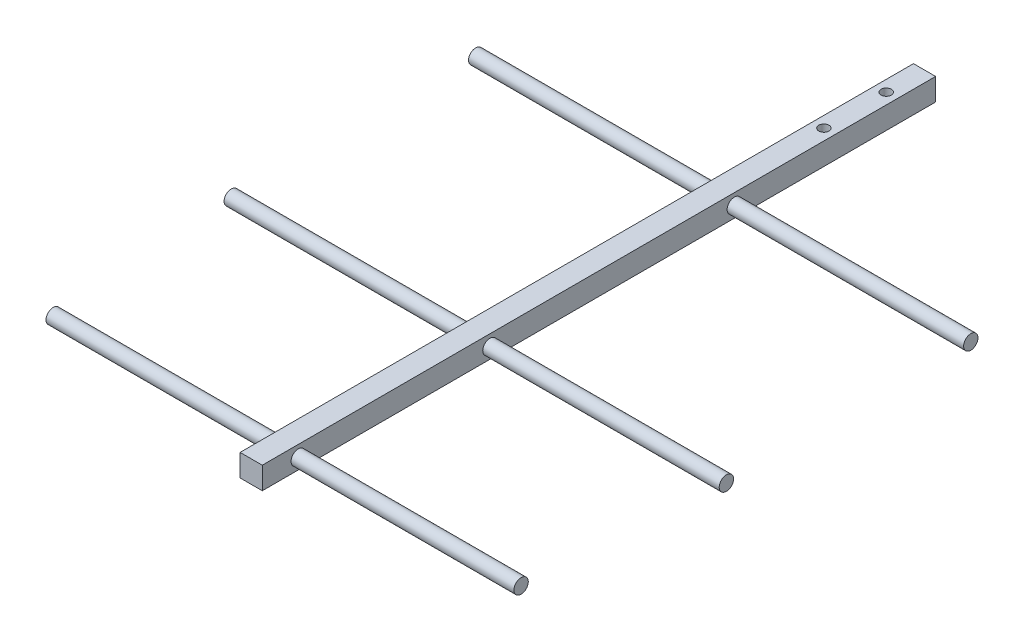
from build123d import *

# Parameters (mm, degrees)
SKETCH1_W                = 14.684375
SKETCH1_H                = 14.684375
BOSS_EXTRUDE1_DEPTH      = 446.0875
SKETCH9_R                = 3.384543224
CUT_EXTRUDE1_DEPTH       = 447.389511797
BOSS_EXTRUDE7_DEPTH      = 155
BOSS_EXTRUDE7_DEPTH_BACK = 155
SKETCH3_R                = 4.7625
BOSS_EXTRUDE8_DEPTH      = 164
BOSS_EXTRUDE8_DEPTH_BACK = 164
SKETCH3_3_R              = 4.7625
BOSS_EXTRUDE9_DEPTH      = 164
BOSS_EXTRUDE9_DEPTH_BACK = 164
SKETCH3_4_R              = 4.7625


with BuildPart() as part:
    # Sketch1 → Boss-Extrude1 (new body)
    with BuildSketch(Plane.XY):
        Rectangle(SKETCH1_W, SKETCH1_H)
    extrude(amount=BOSS_EXTRUDE1_DEPTH)

    # Sketch9 → Cut-Extrude1 (cut, through all)
    with BuildSketch(Plane(origin=(0, 7.3421875, 0), x_dir=(1, 0, 0), z_dir=(0, 1, 0))):
        with Locations((0, -25.4)):
            Circle(SKETCH9_R)
        with Locations((0, -66.675)):
            Circle(SKETCH9_R)
    extrude(amount=-CUT_EXTRUDE1_DEPTH, mode=Mode.SUBTRACT)

    # Sketch3 → Boss-Extrude7 (add, two sides: drawn at the far end of the back side and taken through both)
    with BuildSketch(Plane(origin=(0, 0, 0), x_dir=(0, 0, -1), z_dir=(1, 0, 0)).offset(-BOSS_EXTRUDE7_DEPTH_BACK)):
        with Locations((-422.275, 0)):
            Circle(SKETCH3_R)
    extrude(amount=BOSS_EXTRUDE7_DEPTH + BOSS_EXTRUDE7_DEPTH_BACK)

    # Sketch3<3> → Boss-Extrude8 (add, two sides: drawn at the far end of the back side and taken through both)
    with BuildSketch(Plane(origin=(0, 0, 0), x_dir=(0, 0, -1), z_dir=(1, 0, 0)).offset(-BOSS_EXTRUDE8_DEPTH_BACK)):
        with Locations((-133.35, 0)):
            Circle(SKETCH3_3_R)
    extrude(amount=BOSS_EXTRUDE8_DEPTH + BOSS_EXTRUDE8_DEPTH_BACK)

    # Sketch3<4> → Boss-Extrude9 (add, two sides: drawn at the far end of the back side and taken through both)
    with BuildSketch(Plane(origin=(0, 0, 0), x_dir=(0, 0, -1), z_dir=(1, 0, 0)).offset(-BOSS_EXTRUDE9_DEPTH_BACK)):
        with Locations((-295.275, 0)):
            Circle(SKETCH3_4_R)
    extrude(amount=BOSS_EXTRUDE9_DEPTH + BOSS_EXTRUDE9_DEPTH_BACK)


solid = part.part
